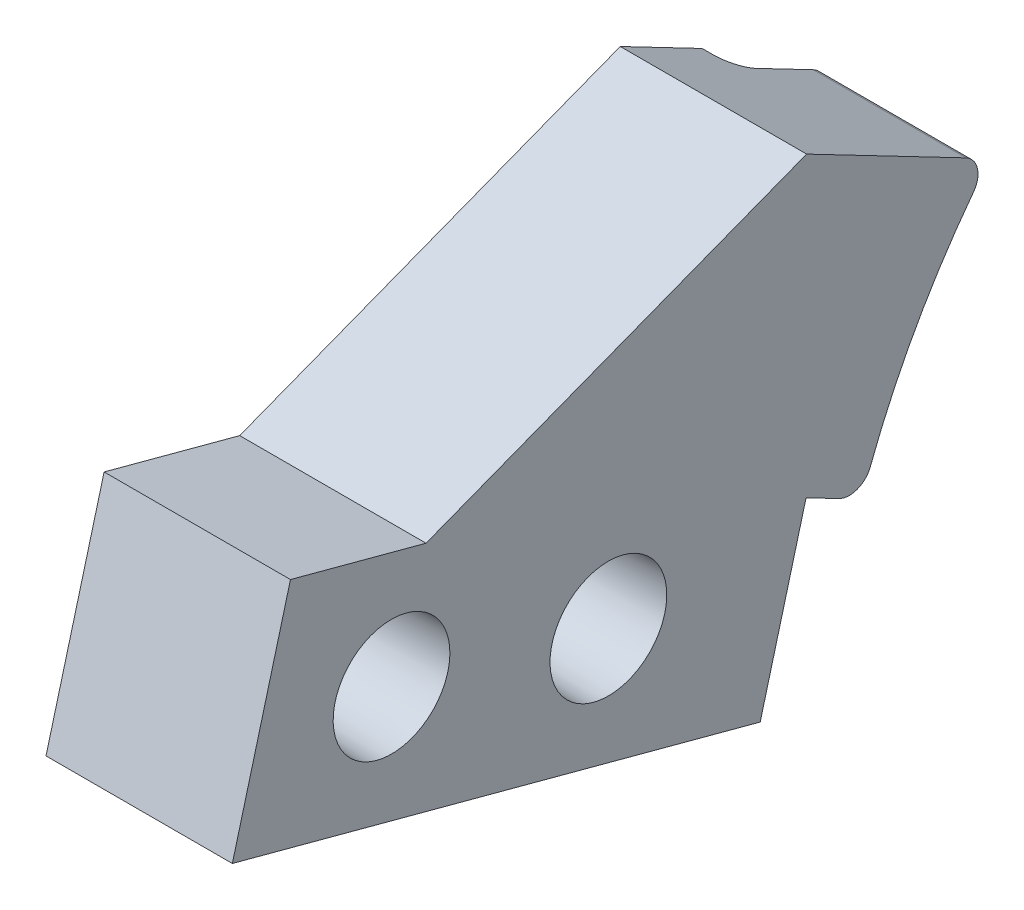
from build123d import *

# Parameters (mm, degrees)
SKETCH1_R                    = 1.7
BOSS_EXTRUDE1_DEPTH          = 1.5
BOSS_EXTRUDE2_START          = 1.5
SKETCH1_3_R                  = 1.7
BOSS_EXTRUDE2_DEPTH          = 1.5
FILLET1_R                    = 1
SKETCH2_R                    = 1.7
BOSS_EXTRUDE3_DEPTH          = 5.3
SKETCH3_R                    = 2.6
CUT_EXTRUDE1_DEPTH           = 3.9
CUT_EXTRUDE1_DRAFT           = -1.5
CUT_EXTRUDE1_PROFILE_2_DEPTH = 3.9
CUT_EXTRUDE1_PROFILE_2_DRAFT = -1.5


with BuildPart() as part:
    # Sketch1 → Boss-Extrude1 (new body)
    with BuildSketch(Plane(origin=(-13.45, 0, 0), x_dir=(0, 0, -1), z_dir=(1, 0, 0))):
        with BuildLine():
            ThreePointArc((-36.90383834, 70.970720842), (-34.276657251, 77.531707495), (-30.494426781, 83.501913439))
            Line((-30.494426781, 83.501913439), (-34.143188918, 85.401338783))
            Line((-34.143188918, 85.401338783), (-51.094135774, 78.867013321))
            Line((-51.094135774, 78.867013321), (-57.13269116, 80.48503936))
            Line((-57.13269116, 80.48503936), (-59.720881611, 70.825781097))
            Line((-59.720881611, 70.825781097), (-45.836878975, 67.105573803))
            Line((-45.836878975, 67.105573803), (-36.90383834, 70.970720842))
        make_face()
        with Locations(Location((-52.631231428, 74.102495958, 0), (0, 0, 270))):
            Circle(SKETCH1_R, mode=Mode.SUBTRACT)
        with Locations(Location((-42.971973165, 71.514305507, 0), (0, 0, 270))):
            Circle(SKETCH1_R, mode=Mode.SUBTRACT)
    extrude(amount=BOSS_EXTRUDE1_DEPTH)

    # Sketch1<3> → Boss-Extrude2 (add)
    with BuildSketch(Plane(origin=(-13.45, 0, 0), x_dir=(0, 0, -1), z_dir=(1, 0, 0)).offset(BOSS_EXTRUDE2_START)):
        with BuildLine():
            Line((-34.143188918, 85.401338783), (-51.094135774, 78.867013321))
            Line((-51.094135774, 78.867013321), (-57.13269116, 80.48503936))
            Line((-57.13269116, 80.48503936), (-59.720881611, 70.825781097))
            Line((-59.720881611, 70.825781097), (-45.836878975, 67.105573803))
            Line((-45.836878975, 67.105573803), (-34.166912695, 72.154933529))
            Line((-34.166912695, 72.154933529), (-32.702433972, 71.39257416))
            ThreePointArc((-32.702433972, 71.39257416), (-31.885174228, 71.344912946), (-31.30617274, 71.923654993))
            ThreePointArc((-31.30617274, 71.923654993), (-29.303876098, 76.233694761), (-26.711829723, 80.21702631))
            ThreePointArc((-26.711829723, 80.21702631), (-26.533623916, 81.040191312), (-27.047449161, 81.707530466))
            Line((-27.047449161, 81.707530466), (-34.143188918, 85.401338783))
        make_face()
        with Locations(Location((-52.631231428, 74.102495958, 0), (0, 0, 270))):
            Circle(SKETCH1_3_R, mode=Mode.SUBTRACT)
        with Locations(Location((-42.971973165, 71.514305507, 0), (0, 0, 270))):
            Circle(SKETCH1_3_R, mode=Mode.SUBTRACT)
    extrude(amount=BOSS_EXTRUDE2_DEPTH)

    # Fillet1
    fillet1_edges = [part.edges().sort_by_distance(p)[0] for p in [
        (-11.95, 77.531707495, 34.276657251),
    ]]
    fillet(fillet1_edges, radius=FILLET1_R)

    # Sketch2 → Boss-Extrude3 (add)
    with BuildSketch(Plane(origin=(-10.45, 0, 0), x_dir=(0, 0, -1), z_dir=(1, 0, 0))):
        with BuildLine():
            Line((-34.166912695, 72.154933529), (-36.210992136, 64.526325198))
            Line((-36.210992136, 64.526325198), (-45.836878975, 67.105573803))
            Line((-45.836878975, 67.105573803), (-59.720881611, 70.825781097))
            Line((-59.720881611, 70.825781097), (-57.13269116, 80.48503936))
            Line((-57.13269116, 80.48503936), (-51.094135774, 78.867013321))
            Line((-51.094135774, 78.867013321), (-34.143188918, 85.401338783))
            Line((-34.143188918, 85.401338783), (-27.047449161, 81.707530466))
            ThreePointArc((-27.047449161, 81.707530466), (-26.533623916, 81.040191312), (-26.711829723, 80.21702631))
            ThreePointArc((-26.711829723, 80.21702631), (-29.303876098, 76.233694761), (-31.30617274, 71.923654993))
            ThreePointArc((-31.30617274, 71.923654993), (-31.885174228, 71.344912946), (-32.702433972, 71.39257416))
            Line((-32.702433972, 71.39257416), (-34.166912695, 72.154933529))
        make_face()
        with Locations(Location((-42.971973165, 71.514305507, 0), (0, 0, 270))):
            Circle(SKETCH2_R, mode=Mode.SUBTRACT)
        with Locations(Location((-52.631231428, 74.102495958, 0), (0, 0, 270))):
            Circle(SKETCH2_R, mode=Mode.SUBTRACT)
    extrude(amount=BOSS_EXTRUDE3_DEPTH)


with BuildPart() as cut_extrude1_tool:
    # Sketch3 → Cut-Extrude1 (with draft: the straight prism first)
    with BuildSketch(Plane(origin=(-5.15, 0, 0), x_dir=(0, 0, -1), z_dir=(1, 0, 0))):
        with Locations((-52.631231428, 74.102495958)):
            Circle(SKETCH3_R)
    extrude(amount=-CUT_EXTRUDE1_DEPTH)
    # Cut-Extrude1: the draft: its side faces are tilted about the plane it starts from
    cut_extrude1_sides = [cut_extrude1_tool.faces().sort_by_distance(p)[0] for p in [
        (-7.1, 74.102495958, 55.231231428),
    ]]
    draft(cut_extrude1_sides, Plane(origin=(-5.15, 0, 0), x_dir=(0, 0, -1), z_dir=(1, 0, 0)), CUT_EXTRUDE1_DRAFT)


with BuildPart() as part_1:
    add(part.part)

    # Cut-Extrude1: cut by cut_extrude1_tool
    add(cut_extrude1_tool.part, mode=Mode.SUBTRACT)


with BuildPart() as cut_extrude1_profile_2_tool:
    # Sketch3 → Cut-Extrude1 profile 2 (with draft: the straight prism first)
    with BuildSketch(Plane(origin=(-5.15, 0, 0), x_dir=(0, 0, -1), z_dir=(1, 0, 0))):
        with Locations((-42.971973165, 71.514305507)):
            Circle(SKETCH3_R)
    extrude(amount=-CUT_EXTRUDE1_PROFILE_2_DEPTH)
    # Cut-Extrude1 profile 2: the draft: its side faces are tilted about the plane it starts from
    cut_extrude1_profile_2_sides = [cut_extrude1_profile_2_tool.faces().sort_by_distance(p)[0] for p in [
        (-7.1, 71.514305507, 45.571973165),
    ]]
    draft(cut_extrude1_profile_2_sides, Plane(origin=(-5.15, 0, 0), x_dir=(0, 0, -1), z_dir=(1, 0, 0)), CUT_EXTRUDE1_PROFILE_2_DRAFT)


with BuildPart() as part_2:
    add(part_1.part)

    # Cut-Extrude1 profile 2: cut by cut_extrude1_profile_2_tool
    add(cut_extrude1_profile_2_tool.part, mode=Mode.SUBTRACT)


solid = part_2.part
